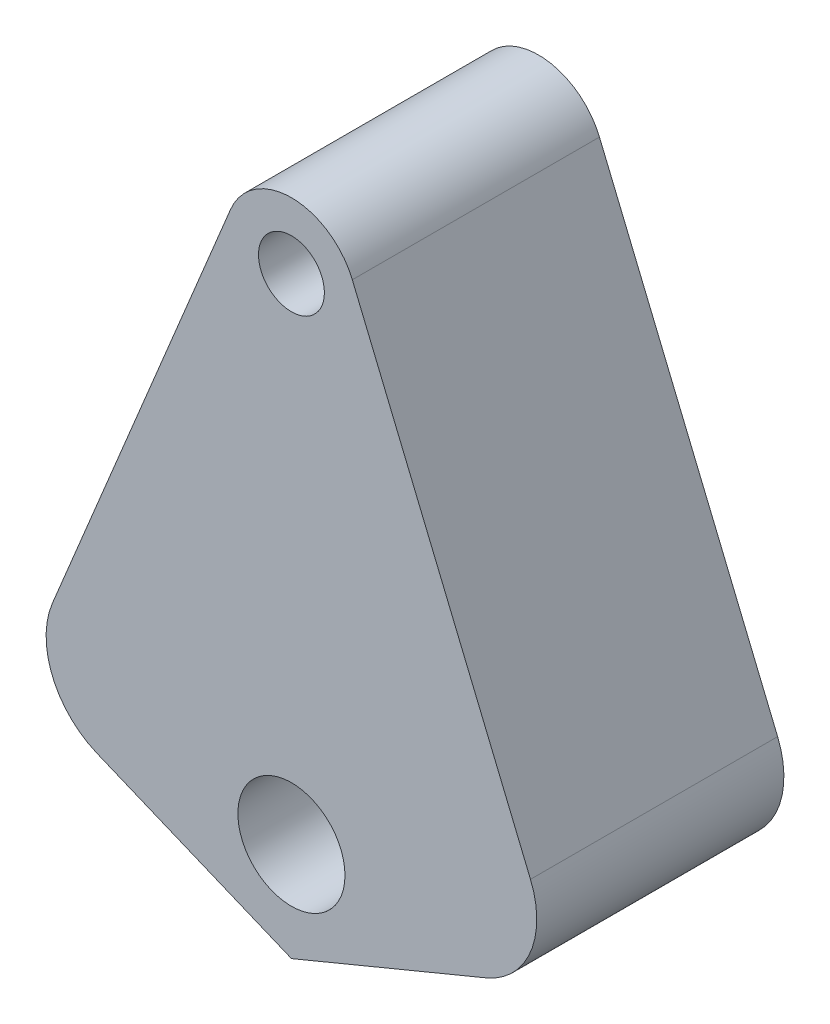
from build123d import *

# Parameters (mm, degrees)
SKETCH_2_R      = 8
SKETCH_2_R_2    = 13
EXTRUDE_1_DEPTH = 30


with BuildPart() as part:
    # Эскиз2 → Бобышка-Вытянуть1 (new, symmetric)
    with BuildSketch(Plane.XY):
        with BuildLine():
            Line((14.78207252, -35.687079958), (58.040092118, -140.121177553))
            ThreePointArc((58.040092118, -140.121177553), (58.040092118, -155.428514848), (47.216170115, -166.252436851))
            Line((47.216170115, -166.252436851), (0, -185.810014876))
            Line((0, -185.810014876), (-47.216170115, -166.252436851))
            ThreePointArc((-47.216170115, -166.252436851), (-58.040092118, -155.428514848), (-58.040092118, -140.121177553))
            Line((-58.040092118, -140.121177553), (-14.78207252, -35.687079958))
            ThreePointArc((-14.78207252, -35.687079958), (0, -25.810014876), (14.78207252, -35.687079958))
        make_face()
        with Locations((0, -41.810014876)):
            Circle(SKETCH_2_R, mode=Mode.SUBTRACT)
        with Locations((0, -161.810014876)):
            Circle(SKETCH_2_R_2, mode=Mode.SUBTRACT)
    extrude(amount=EXTRUDE_1_DEPTH, both=True)


solid = part.part
